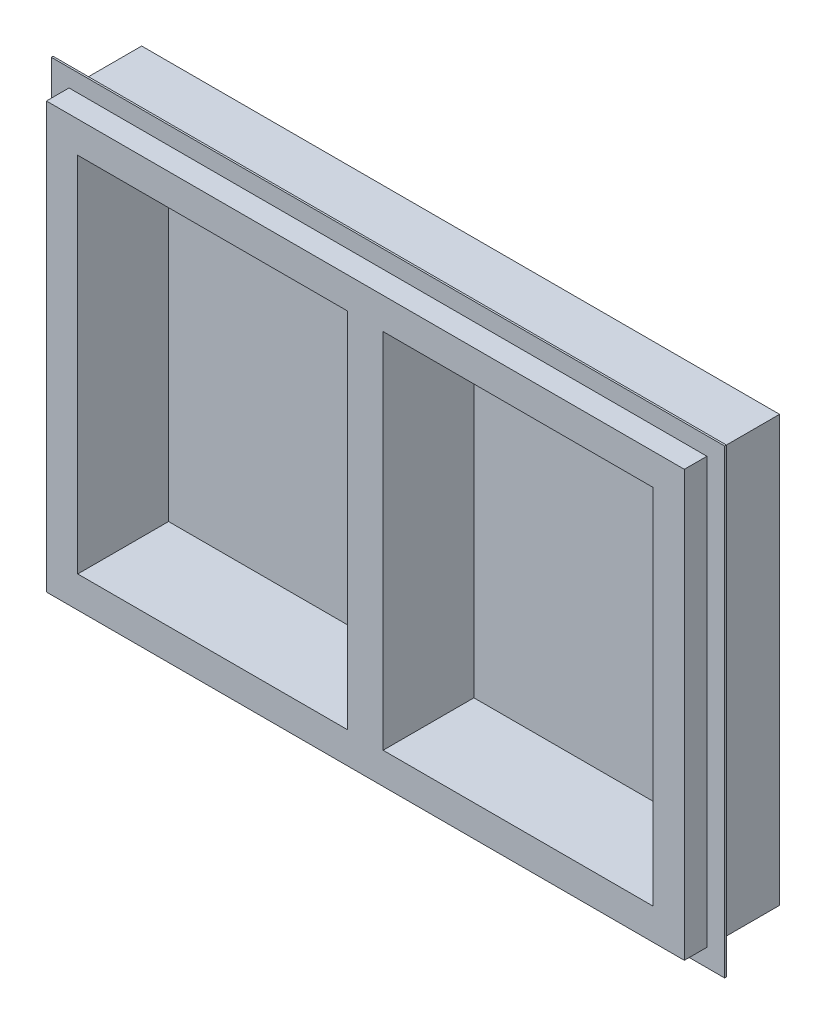
from build123d import *

# Parameters (mm, degrees)
SKETCH1_W                = 914.4
SKETCH1_H                = 609.6
SKETCH1_W_2              = 824.59743879
SKETCH1_H_2              = 519.79743879
BOSS_EXTRUDE1_DEPTH      = 101.6
SKETCH2_W                = 914.4
SKETCH2_H                = 609.6
BOSS_EXTRUDE2_DEPTH      = 2.54
BOSS_EXTRUDE3_REACH      = 1116.579
SKETCH4_W                = 914.4
SKETCH4_H                = 609.6
SKETCH4_W_2              = 386.898719395
SKETCH4_H_2              = 519.79743879
BOSS_EXTRUDE4_DEPTH      = 34.925
BOSS_EXTRUDE5_DEPTH      = 0.0254
BOSS_EXTRUDE5_DEPTH_BACK = 6.35
SKETCH5_W                = 386.898719395
SKETCH5_H                = 519.79743879


with BuildPart() as part:
    # Sketch1 → Boss-Extrude1 (new body)
    with BuildSketch(Plane.XY):
        with Locations((457.2, 304.8)):
            Rectangle(SKETCH1_W, SKETCH1_H)
        with Locations((457.2, 304.8)):
            Rectangle(SKETCH1_W_2, SKETCH1_H_2, mode=Mode.SUBTRACT)
    extrude(amount=BOSS_EXTRUDE1_DEPTH)

    # Sketch3 → Boss-Extrude3 (add, up to next)
    with BuildSketch(Plane(origin=(0, 44.901280605, 0), x_dir=(1, 0, 0), z_dir=(0, 1, 0)), mode=Mode.PRIVATE) as boss_extrude3_sk1:
        Polygon((457.2, 0), (482.6, 0), (482.6, -101.6), (431.8, -101.6), (431.8, 0), align=None)
    boss_extrude3_tool1 = extrude(boss_extrude3_sk1.sketch, amount=BOSS_EXTRUDE3_REACH, mode=Mode.PRIVATE) - part.part
    add(boss_extrude3_tool1.solids().sort_by_distance((457.2, 44.901281, 50.8))[0])



with BuildPart() as body_2:
    # Sketch2 → Boss-Extrude2 (new body)
    with BuildSketch(Plane.XY.offset(101.6)):
        Polygon((0, 635), (939.8, 635), (939.8, -25.4), (-25.4, -25.4), (-25.4, 635), align=None)
        with Locations((457.2, 304.8)):
            Rectangle(SKETCH2_W, SKETCH2_H, mode=Mode.SUBTRACT)
    extrude(amount=BOSS_EXTRUDE2_DEPTH)


with BuildPart() as part_1:
    add(part.part)

    add(body_2.part)  # Boss-Extrude4 merges body 2
    # Sketch4 → Boss-Extrude4 (add)
    with BuildSketch(Plane.XY.offset(101.6)):
        with Locations((457.2, 304.8)):
            Rectangle(SKETCH4_W, SKETCH4_H)
        with Locations((238.350640303, 304.8)):
            Rectangle(SKETCH4_W_2, SKETCH4_H_2, mode=Mode.SUBTRACT)
        with Locations((676.049359697, 304.8)):
            Rectangle(SKETCH4_W_2, SKETCH4_H_2, mode=Mode.SUBTRACT)
    extrude(amount=BOSS_EXTRUDE4_DEPTH)

    # Sketch5 → Boss-Extrude5 (add, two sides: drawn at the far end of the back side and taken through both)
    with BuildSketch(Plane(origin=(0, 0, 0), x_dir=(-1, 0, 0), z_dir=(0, 0, -1)).offset(-BOSS_EXTRUDE5_DEPTH_BACK)):
        with Locations((-676.049359697, 304.8)):
            Rectangle(SKETCH5_W, SKETCH5_H)
        with Locations((-238.350640303, 304.8)):
            Rectangle(SKETCH5_W, SKETCH5_H)
    extrude(amount=BOSS_EXTRUDE5_DEPTH + BOSS_EXTRUDE5_DEPTH_BACK)


solid = part_1.part
